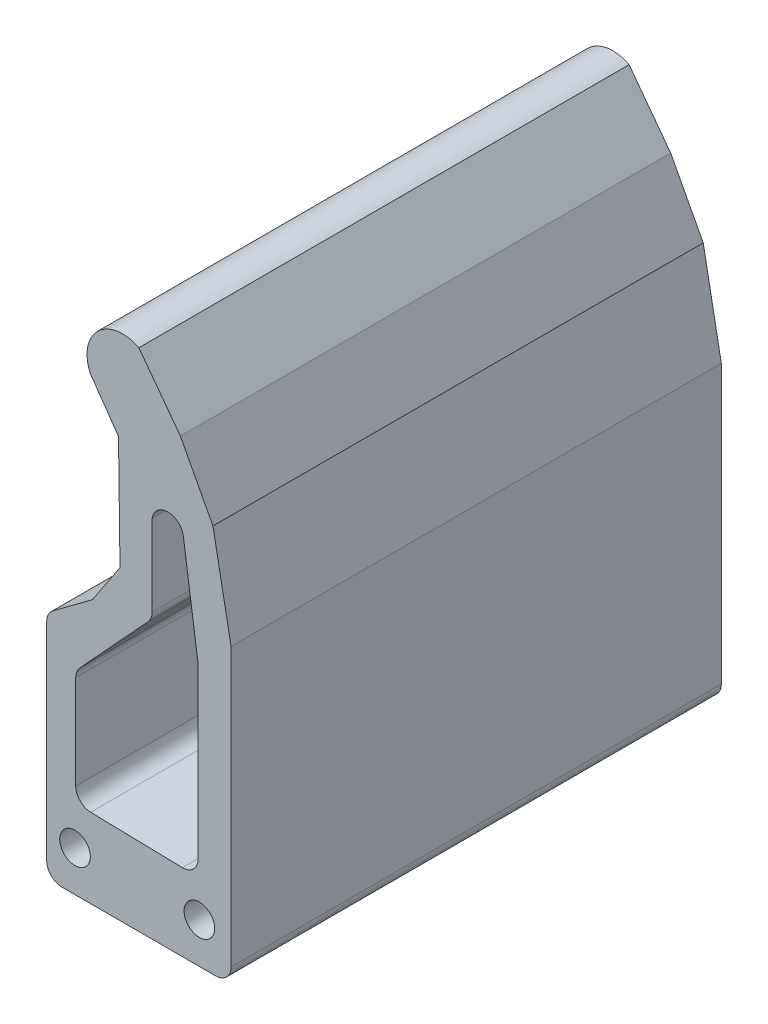
from build123d import *

# Parameters (mm, degrees)
BOSS_EXTRUDE1_DEPTH = 32
FILLET1_R           = 1
SKETCH2_R           = 1
CUT_EXTRUDE1_DEPTH  = 32


with BuildPart() as part:
    # Sketch1 → Boss-Extrude1 (new body)
    with BuildSketch(Plane.XY.offset(40)):
        with BuildLine():
            Line((-312.030492528, 377.868524993), (-310.193868717, 375.244776692))
            Line((-310.193868717, 375.244776692), (-310.096008301, 367.875213623))
            Line((-310.096008301, 367.875213623), (-311.889068604, 365.166412354))
            Line((-311.889068604, 365.166412354), (-314.88168335, 362.936676025))
            Line((-314.88168335, 362.936676025), (-314.88168335, 347.918438133))
            Line((-314.88168335, 347.918438133), (-302.847373473, 347.918438133))
            Line((-302.847373473, 347.918438133), (-302.847373473, 367.04556325))
            Line((-302.847373473, 367.04556325), (-304.028060208, 373.263846724))
            Line((-304.028060208, 373.263846724), (-306.153296332, 377.278181625))
            Line((-306.153296332, 377.278181625), (-308.864528411, 380.917030307))
            ThreePointArc((-308.864528411, 380.917030307), (-311.535911341, 380.523114569), (-312.030492528, 377.868524993))
        make_face()
        with BuildLine():
            Line((-312.988408734, 360.598376943), (-312.988408734, 353.109979303))
            Line((-312.988408734, 353.109979303), (-305, 352.927314193))
            Line((-305, 352.927314193), (-305, 365))
            Line((-305, 365), (-305.952850342, 371.670013428))
            ThreePointArc((-305.952850342, 371.670013428), (-306.959348498, 372.584855641), (-307.99460106, 371.702683918))
            Line((-307.99460106, 371.702683918), (-307.99460106, 366.023339102))
            Line((-307.99460106, 366.023339102), (-312.988408734, 360.598376943))
        make_face(mode=Mode.SUBTRACT)
    extrude(amount=BOSS_EXTRUDE1_DEPTH)

    # Fillet1
    fillet1_edges = [part.edges().sort_by_distance(p)[0] for p in [
        (-302.847373473, 347.918438133, 56),
        (-314.88168335, 347.918438133, 56),
        (-314.88168335, 362.936676025, 56),
        (-307.99460106, 366.023339102, 56),
        (-312.988408734, 360.598376943, 56),
        (-312.988408734, 353.109979303, 56),
        (-305, 352.927314193, 56),
    ]]
    fillet(fillet1_edges, radius=FILLET1_R)

    # Sketch2 → Cut-Extrude1 (cut)
    with BuildSketch(Plane.XY.offset(72)):
        with Locations((-313.031111026, 350.560286037)):
            Circle(SKETCH2_R)
        with Locations((-304.91451991, 350.560286037)):
            Circle(SKETCH2_R)
    extrude(amount=-CUT_EXTRUDE1_DEPTH, mode=Mode.SUBTRACT)


solid = part.part
